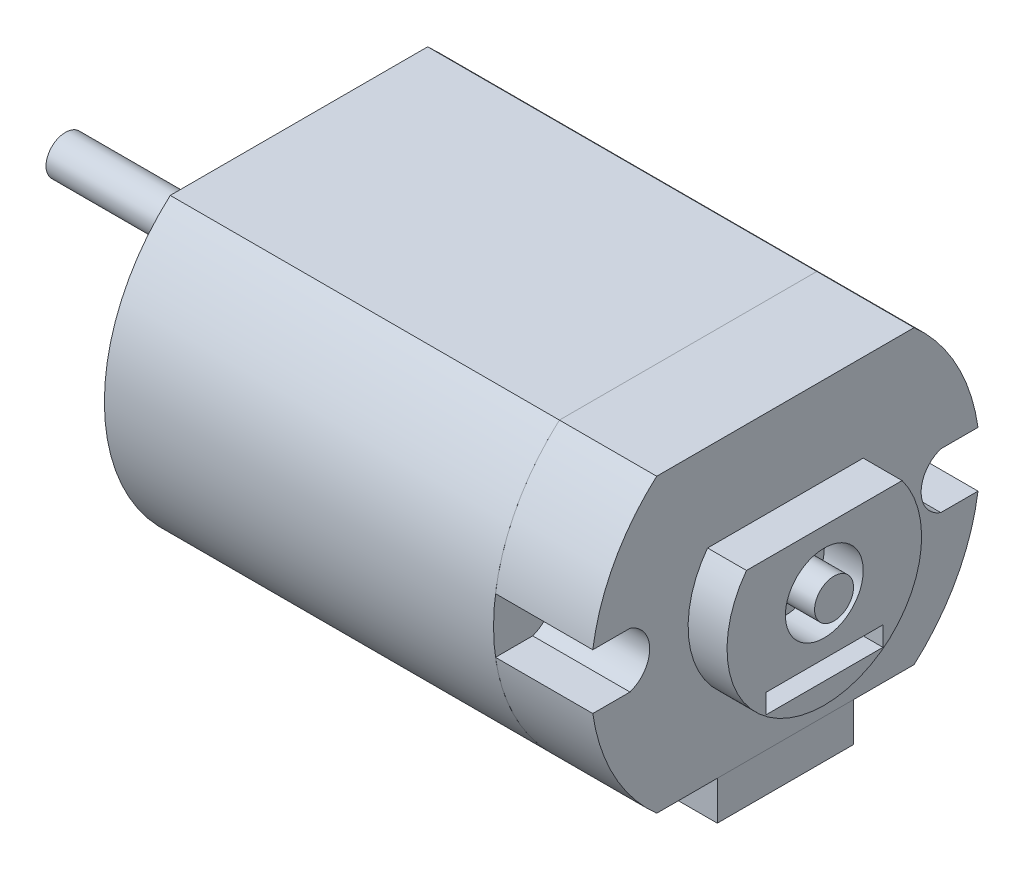
from build123d import *

# Parameters (mm, degrees)
BOSS_EXTRUDE1_DEPTH      = 7.5
BOSS_EXTRUDE1_DEPTH_BACK = 12.5
BOSS_EXTRUDE2_DEPTH      = 5
SKETCH3_R                = 1
BOSS_EXTRUDE3_DEPTH      = 2.5
SKETCH3_6_W              = 6
SKETCH3_6_H              = 1
SKETCH3_6_R              = 2
BOSS_EXTRUDE6_DEPTH      = 2
SKETCH3_7_W              = 7
SKETCH3_7_H              = 2
BOSS_EXTRUDE7_DEPTH      = 5
SKETCH4_R                = 1
BOSS_EXTRUDE9_DEPTH      = 12
SKETCH4_3_R              = 3
SKETCH4_3_R_2            = 1
BOSS_EXTRUDE10_DEPTH     = 2


with BuildPart() as part:
    # Sketch1 → Boss-Extrude1 (new, two sides: drawn at the far end of the back side and taken through both)
    with BuildSketch(Plane(origin=(0, 0, 0), x_dir=(0, 0, -1), z_dir=(1, 0, 0)).offset(-BOSS_EXTRUDE1_DEPTH_BACK)):
        with BuildLine():
            Line((-6.614378278, -7.5), (6.614378278, -7.5))
            ThreePointArc((6.614378278, -7.5), (10, 0), (6.614378278, 7.5))
            Line((6.614378278, 7.5), (-6.614378278, 7.5))
            ThreePointArc((-6.614378278, 7.5), (-10, 0), (-6.614378278, -7.5))
        make_face()
    extrude(amount=BOSS_EXTRUDE1_DEPTH + BOSS_EXTRUDE1_DEPTH_BACK)

    # Sketch4<3> → Boss-Extrude10 (add)
    with BuildSketch(Plane.ZY.offset(12.5)):
        Circle(SKETCH4_3_R)
        Circle(SKETCH4_3_R_2, mode=Mode.SUBTRACT)
    extrude(amount=BOSS_EXTRUDE10_DEPTH)


with BuildPart() as body_2:
    # Sketch2 → Boss-Extrude2 (new body)
    with BuildSketch(Plane(origin=(7.5, 0, 0), x_dir=(0, 0, -1), z_dir=(1, 0, 0))):
        with BuildLine():
            Line((-6.614378278, 7.5), (6.614378278, 7.5))
            ThreePointArc((6.614378278, 7.5), (8.798827688, 4.751908176), (9.898924717, 1.418199367))
            Line((9.898924717, 1.418199367), (7.986999742, 1.418199367))
            ThreePointArc((7.986999742, 1.418199367), (6.975579885, 0), (7.986999742, -1.418199367))
            Line((7.986999742, -1.418199367), (9.898924717, -1.418199367))
            ThreePointArc((9.898924717, -1.418199367), (8.798827688, -4.751908176), (6.614378278, -7.5))
            Line((6.614378278, -7.5), (-6.614378278, -7.5))
            ThreePointArc((-6.614378278, -7.5), (-8.798827688, -4.751908176), (-9.898924717, -1.418199367))
            Line((-9.898924717, -1.418199367), (-7.986999742, -1.418199367))
            ThreePointArc((-7.986999742, -1.418199367), (-6.975579885, 0), (-7.986999742, 1.418199367))
            Line((-7.986999742, 1.418199367), (-9.898924717, 1.418199367))
            ThreePointArc((-9.898924717, 1.418199367), (-8.798827688, 4.751908176), (-6.614378278, 7.5))
        make_face()
    extrude(amount=BOSS_EXTRUDE2_DEPTH)


with BuildPart() as body_3:
    # Sketch3 → Boss-Extrude3 (new body)
    with BuildSketch(Plane(origin=(12.5, 0, 0), x_dir=(0, 0, -1), z_dir=(1, 0, 0))):
        Circle(SKETCH3_R)
    extrude(amount=BOSS_EXTRUDE3_DEPTH)


with BuildPart() as body_4:
    # Sketch3<6> → Boss-Extrude6 (new body)
    with BuildSketch(Plane(origin=(12.5, 0, 0), x_dir=(0, 0, -1), z_dir=(1, 0, 0))):
        with BuildLine():
            Line((4, 3), (-4, 3))
            ThreePointArc((-4, 3), (0, -5), (4, 3))
        make_face()
        with Locations((0.012157956, -3.427042932)):
            Rectangle(SKETCH3_6_W, SKETCH3_6_H, mode=Mode.SUBTRACT)
        Circle(SKETCH3_6_R, mode=Mode.SUBTRACT)
    extrude(amount=BOSS_EXTRUDE6_DEPTH)


with BuildPart() as body_5:
    # Sketch3<7> → Boss-Extrude7 (new body)
    with BuildSketch(Plane(origin=(12.5, 0, 0), x_dir=(0, 0, -1), z_dir=(1, 0, 0))):
        with Locations((0, -8.5)):
            Rectangle(SKETCH3_7_W, SKETCH3_7_H)
    extrude(amount=-BOSS_EXTRUDE7_DEPTH)


with BuildPart() as body_6:
    # Sketch4 → Boss-Extrude9 (new body)
    with BuildSketch(Plane.ZY.offset(12.5)):
        Circle(SKETCH4_R)
    extrude(amount=BOSS_EXTRUDE9_DEPTH)


solid = Compound([part.part, body_2.part, body_3.part, body_4.part, body_5.part, body_6.part])
